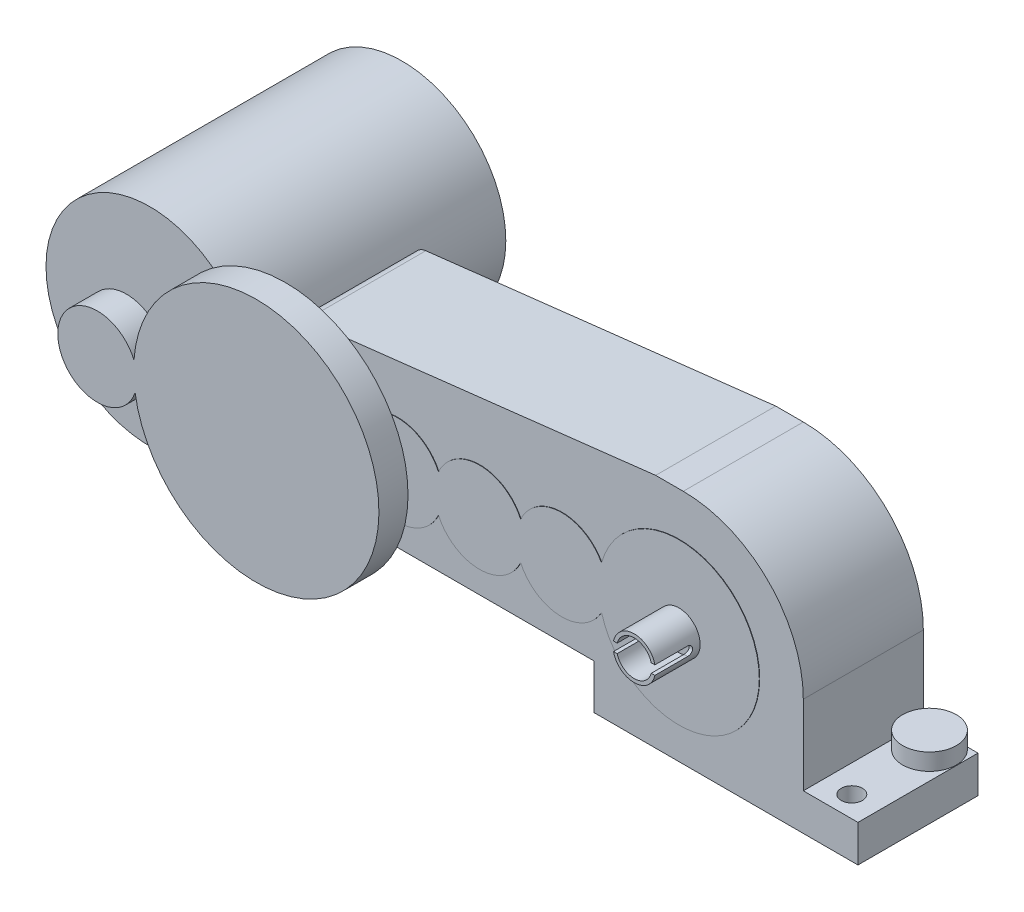
from build123d import *

# Parameters (mm, degrees)
EXTRUDE1_DEPTH    = 10.8712
SKETCH3_R         = 3.81
SKETCH3_R_2       = 3.170677591
EXTRUDE2_DEPTH    = 18.923
EXTRUDE3_DEPTH    = 10.795
SKETCH6_R         = 1.905
EXTRUDE4_DEPTH    = 21.59
SKETCH7_R         = 1.27
EXTRUDE5_DEPTH    = 18.669
EXTRUDE6_START    = 38.1
EXTRUDE6_DEPTH    = 10
SKETCH9_R         = 15.5829
EXTRUDE7_DEPTH    = 1.5494
EXTRUDE8_DEPTH    = 5.2324
EXTRUDE9_START    = 4.191
SKETCH11_R        = 18.669
EXTRUDE9_DEPTH    = 45.3644
SKETCH14_R        = 4.826
EXTRUDE10_DEPTH   = 3.0226
EXTRUDE10_2_DEPTH = 3.0226


with BuildPart() as part:
    # Sketch1 → Extrude1 (new, symmetric)
    with BuildSketch(Plane.XY):
        with BuildLine():
            ThreePointArc((19.458991626, 4.314801956), (12.038580445, 8.580199555), (4.913681626, 3.837633204))
            ThreePointArc((4.913681626, 3.837633204), (-2.477718374, 8.584569756), (-9.869118374, 3.837633204))
            ThreePointArc((-9.869118374, 3.837633204), (-15.272484602, 8.337693135), (-22.163825334, 6.939004858))
            ThreePointArc((-22.163825334, 6.939004858), (-33.125915624, 9.855374055), (-25.30153955, 1.642471287))
            ThreePointArc((-25.30153955, 1.642471287), (-19.566986279, -7.337311806), (-9.869118374, -2.924493692))
            ThreePointArc((-9.869118374, -2.924493692), (-2.477718374, -7.671430244), (4.913681626, -2.924493692))
            ThreePointArc((4.913681626, -2.924493692), (12.038580445, -7.667060044), (19.458991626, -3.401662445))
            ThreePointArc((19.458991626, -3.401662445), (47.839681626, 0.456569756), (19.458991626, 4.314801956))
        make_face()
    extrude(amount=EXTRUDE1_DEPTH, both=True)

    # Sketch3 → Extrude2 (add, symmetric)
    with BuildSketch(Plane.XY):
        with Locations((33.387081626, 0.456569756)):
            Circle(SKETCH3_R)
        with Locations((33.387081626, 0.456569756)):
            Circle(SKETCH3_R_2, mode=Mode.SUBTRACT)
    extrude(amount=EXTRUDE2_DEPTH, both=True)



with BuildPart() as body_2:
    # Sketch4 → Extrude3 (new, symmetric)
    with BuildSketch(Plane.XY):
        with BuildLine():
            Line((-33.811698743, 15.464508517), (29.122706406, 22.739327964))
            Line((29.122706406, 22.739327964), (34.085517936, 22.739327964))
            ThreePointArc((34.085517936, 22.739327964), (49.351953342, 16.415763369), (55.675517936, 1.149327964))
            Line((55.675517936, 1.149327964), (55.675517936, -13.120714332))
            Line((55.675517936, -13.120714332), (65.506269991, -13.120714332))
            Line((65.506269991, -13.120714332), (65.506269991, -19.76149571))
            Line((65.506269991, -19.76149571), (18.058263176, -19.76149571))
            Line((18.058263176, -19.76149571), (18.058263176, -11.714308248))
            Line((18.058263176, -11.714308248), (-27.479401564, -11.714308248))
            Line((-27.479401564, -11.714308248), (-27.479401564, -19.76149571))
            Line((-27.479401564, -19.76149571), (-45.313440802, -19.76149571))
            Line((-45.313440802, -19.76149571), (-45.313440802, -13.120714332))
            Line((-45.313440802, -13.120714332), (-36.060032936, -13.120714332))
            Line((-36.060032936, -13.120714332), (-36.060032936, 12.941309941))
            ThreePointArc((-36.060032936, 12.941309941), (-35.416401986, 14.631098219), (-33.811698743, 15.464508517))
        make_face()
    extrude(amount=EXTRUDE3_DEPTH, both=True)

    # Sketch6 → Extrude4 (cut)
    with BuildSketch(Plane(origin=(0, 0, 0), x_dir=(1, 0, 0), z_dir=(0, 1, 0))):
        with Locations(Location((-40.686736869, 6.985, 0), (0, 0, 270))):
            Circle(SKETCH6_R)
        with Locations(Location((60.590893964, 6.985, 0), (0, 0, 270))):
            Circle(SKETCH6_R)
        with Locations(Location((60.590893964, -6.985, 0), (0, 0, 270))):
            Circle(SKETCH6_R)
        with Locations(Location((-40.686736869, -6.985, 0), (0, 0, 270))):
            Circle(SKETCH6_R)
    extrude(amount=-EXTRUDE4_DEPTH, mode=Mode.SUBTRACT)


with BuildPart() as part_1:
    add(part.part)

    add(body_2.part)  # Extrude5 merges body 2
    # Sketch7 → Extrude5 (add)
    with BuildSketch(Plane.XY):
        with Locations(Location((-28.055981517, 6.851899403, 0), (0, 0, 180))):
            Circle(SKETCH7_R)
    extrude(amount=EXTRUDE5_DEPTH)

    # Sketch8 → Extrude6 (cut)
    with BuildSketch(Plane(origin=(0, 0, 0), x_dir=(0, 0, -1), z_dir=(1, 0, 0)).offset(EXTRUDE6_START)):
        with BuildLine():
            Line((-13.032080809, 1.274989594), (-21.09710677, 1.274989594))
            Line((-21.09710677, 1.274989594), (-21.09710677, -0.361850083))
            Line((-21.09710677, -0.361850083), (-13.032080809, -0.361850083))
            ThreePointArc((-13.032080809, -0.361850083), (-12.21366097, 0.456569756), (-13.032080809, 1.274989594))
        make_face()
        with BuildLine():
            Line((13.032080809, -0.361850083), (21.09710677, -0.361850083))
            Line((21.09710677, -0.361850083), (21.09710677, 1.274989594))
            Line((21.09710677, 1.274989594), (13.032080809, 1.274989594))
            ThreePointArc((13.032080809, 1.274989594), (12.21366097, 0.456569756), (13.032080809, -0.361850083))
        make_face()
    extrude(amount=-EXTRUDE6_DEPTH, mode=Mode.SUBTRACT)

    # Sketch9 → Extrude7 (add)
    with BuildSketch(Plane.XY.offset(18.669)):
        with Locations((-28.055981517, 6.851899403)):
            Circle(SKETCH9_R)
    extrude(amount=EXTRUDE7_DEPTH)

    # Sketch10 → Extrude8 (add)
    with BuildSketch(Plane.XY.offset(20.2184)):
        with BuildLine():
            ThreePointArc((-49.85657983, 3.479496518), (-6.014557557, 7.754572016), (-50.059335598, 8.430378799))
            ThreePointArc((-50.059335598, 8.430378799), (-63.75116033, 5.390058263), (-49.85657983, 3.479496518))
        make_face()
    extrude(amount=EXTRUDE8_DEPTH)


with BuildPart() as body_2_2:
    # Sketch11 → Extrude9 (new body)
    with BuildSketch(Plane(origin=(0, 0, 20.2184), x_dir=(-1, 0, 0), z_dir=(0, 0, -1)).offset(EXTRUDE9_START)):
        with Locations((56.632427548, 5.681595013)):
            Circle(SKETCH11_R)
    extrude(amount=EXTRUDE9_DEPTH)


with BuildPart() as body_3:
    # Sketch14 → Extrude10 (new body)
    with BuildSketch(Plane(origin=(0, -13.120714332, 0), x_dir=(1, 0, 0), z_dir=(0, 1, 0))):
        with Locations(Location((60.590893964, 6.985, 0), (0, 0, 270))):
            Circle(SKETCH14_R)
    extrude(amount=EXTRUDE10_DEPTH)


with BuildPart() as body_4:
    # Sketch14 → Extrude10 2 (new body)
    with BuildSketch(Plane(origin=(0, -13.120714332, 0), x_dir=(1, 0, 0), z_dir=(0, 1, 0))):
        with Locations(Location((-41.174810527, 6.985, 0), (0, 0, 270))):
            Circle(SKETCH14_R)
    extrude(amount=EXTRUDE10_2_DEPTH)


solid = Compound([part_1.part, body_2_2.part, body_3.part, body_4.part])
